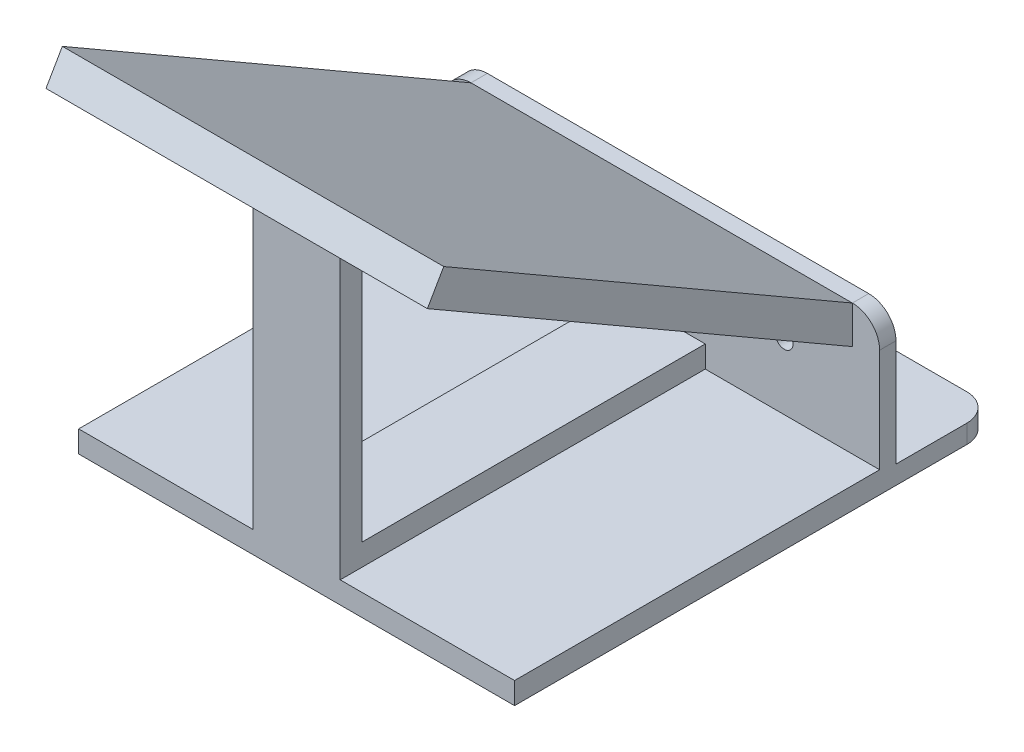
from build123d import *

# Parameters (mm, degrees)
SKETCH_1_W           = 80
SKETCH_1_H           = 24
SKETCH_1_R           = 1.6
EXTRUDE_1_DEPTH      = 3
SKETCH_2_W           = 80
SKETCH_2_H           = 70
EXTRUDE_2_DEPTH      = 4
SKETCH_3_W           = 80
SKETCH_3_H           = 18
EXTRUDE_3_DEPTH      = 4
SKETCH_4_W           = 80
SKETCH_4_H           = 18
CUT_EXTRUDE_1_DEPTH  = 0.6
FILLET_1_R           = 5
FILLET_2_R           = 5
SKETCH_5_W           = 16
SKETCH_5_H           = 67
EXTRUDE_4_DEPTH      = 4
SKETCH_6_W           = 16
SKETCH_6_H           = 40
EXTRUDE_5_DEPTH      = 4
EXTRUDE_6_DEPTH      = 35
EXTRUDE_6_DEPTH_BACK = 35
SKETCH_9_W           = 16
SKETCH_9_H           = 15
EXTRUDE_7_DEPTH      = 4
EXTRUDE_9_DEPTH      = 70


with BuildPart() as part:
    # 草图1 → 凸台-拉伸1 (new body)
    with BuildSketch(Plane.XY):
        Rectangle(SKETCH_1_W, SKETCH_1_H)
        with Locations((-22.5, 0)):
            Circle(SKETCH_1_R, mode=Mode.SUBTRACT)
        with Locations(Location((22.5, 0, 0), (0, 0, 180))):
            Circle(SKETCH_1_R, mode=Mode.SUBTRACT)
    extrude(amount=EXTRUDE_1_DEPTH)

    # 草图2 → 凸台-拉伸2 (add)
    with BuildSketch(Plane.XZ.offset(12)):
        with Locations((0, 35)):
            Rectangle(SKETCH_2_W, SKETCH_2_H)
    extrude(amount=EXTRUDE_2_DEPTH)

    # 草图3 → 凸台-拉伸3 (add)
    with BuildSketch(Plane.XZ.offset(16)):
        with Locations((0, -9)):
            Rectangle(SKETCH_3_W, SKETCH_3_H)
    extrude(amount=-EXTRUDE_3_DEPTH)

    # 草图4 → 切除-拉伸1 (cut)
    with BuildSketch(Plane(origin=(0, -12, 0), x_dir=(1, 0, 0), z_dir=(0, 1, 0))):
        with Locations((0, 9)):
            Rectangle(SKETCH_4_W, SKETCH_4_H)
    extrude(amount=-CUT_EXTRUDE_1_DEPTH, mode=Mode.SUBTRACT)

    # 圆角1
    fillet_1_edges = [part.edges().sort_by_distance(p)[0] for p in [
        (-40, -14.3, -18),
        (40, -14.3, -18),
    ]]
    fillet(fillet_1_edges, radius=FILLET_1_R)

    # 圆角2
    fillet_2_edges = [part.edges().sort_by_distance(p)[0] for p in [
        (-40, 12, 1.5),
        (40, 12, 1.5),
    ]]
    fillet(fillet_2_edges, radius=FILLET_2_R)

    # 草图5 → 凸台-拉伸4 (add)
    with BuildSketch(Plane(origin=(0, -12, 0), x_dir=(1, 0, 0), z_dir=(0, 1, 0))):
        with Locations((0, -36.5)):
            Rectangle(SKETCH_5_W, SKETCH_5_H)
    extrude(amount=EXTRUDE_4_DEPTH)

    # 草图6 → 凸台-拉伸5 (add)
    with BuildSketch(Plane.XY.offset(70)):
        with Locations((0, 12)):
            Rectangle(SKETCH_6_W, SKETCH_6_H)
    extrude(amount=-EXTRUDE_5_DEPTH)

    # 草图8 → 凸台-拉伸6 (add, two sides: drawn at the far end of the back side and taken through both)
    with BuildSketch(Plane.ZY.offset(-EXTRUDE_6_DEPTH_BACK)):
        Polygon((3, 12), (78, 55.301270189), (78, 48.373066959), (3, 5.07179677), align=None)
    extrude(amount=EXTRUDE_6_DEPTH + EXTRUDE_6_DEPTH_BACK)

    # 草图9 → 凸台-拉伸7 (add)
    with BuildSketch(Plane(origin=(0, 0, 66), x_dir=(-1, 0, 0), z_dir=(0, 0, -1))):
        with Locations((0, 39.5)):
            Rectangle(SKETCH_9_W, SKETCH_9_H)
    extrude(amount=-EXTRUDE_7_DEPTH)

    # 草图11 → 凸台-拉伸9 (add)
    with BuildSketch(Plane(origin=(35, 0, 0), x_dir=(0, 0, -1), z_dir=(1, 0, 0))):
        Polygon((-78, 48.373066959), (-81, 50.105117767), (-78, 55.301270189), align=None)
    extrude(amount=-EXTRUDE_9_DEPTH)


solid = part.part
